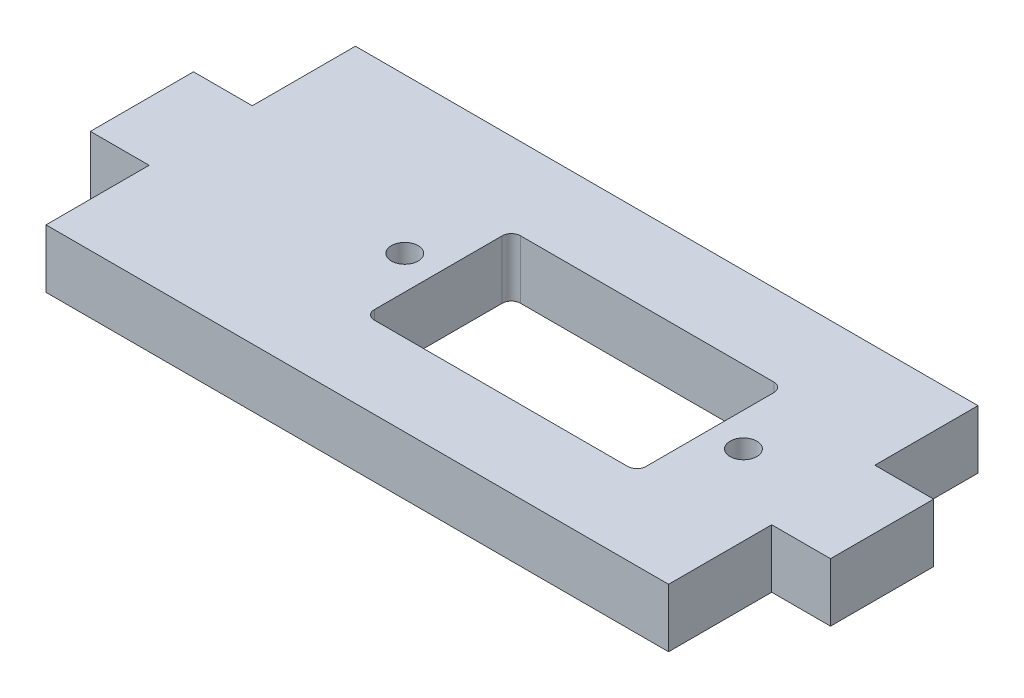
from build123d import *

# Parameters (mm, degrees)
SKETCH1_W           = 101.6
SKETCH1_H           = 25.4
BOSS_EXTRUDE1_DEPTH = 4.800000052
SKETCH2_R           = 1.1
CUT_EXTRUDE1_DEPTH  = 105.836825593
SKETCH3_W           = 4.826
SKETCH3_H           = 8.466666667
CUT_EXTRUDE2_DEPTH  = 105.836825593
SKETCH4_W           = 17.969778324
SKETCH4_H           = 25.4
SKETCH4_W_2         = 22.871809623
CUT_EXTRUDE3_DEPTH  = 105.836825593


with BuildPart() as part:
    # Sketch1 → Boss-Extrude1 (new body)
    with BuildSketch(Plane(origin=(0, 0, 0), x_dir=(1, 0, 0), z_dir=(0, 1, 0))):
        with Locations((50.8, 12.7)):
            Rectangle(SKETCH1_W, SKETCH1_H)
    extrude(amount=BOSS_EXTRUDE1_DEPTH)

    # Sketch2 → Cut-Extrude1 (cut, through all)
    with BuildSketch(Plane(origin=(0, 4.800000052, 0), x_dir=(1, 0, 0), z_dir=(0, 1, 0))):
        with Locations(Location((72.250000026, 12.7, 0), (0, 0, 270))):
            Circle(SKETCH2_R)
        with Locations(Location((44.450000026, 12.7, 0), (0, 0, 270))):
            Circle(SKETCH2_R)
    extrude(amount=-CUT_EXTRUDE1_DEPTH, mode=Mode.SUBTRACT)

    # Sketch3 → Cut-Extrude2 (cut, through all)
    with BuildSketch(Plane.XZ):
        with BuildLine():
            Line((69.500000026, -17.95), (69.500000026, -7.45))
            ThreePointArc((69.500000026, -7.45), (69.280330112, -6.919669914), (68.750000026, -6.7))
            Line((68.750000026, -6.7), (47.950000026, -6.7))
            ThreePointArc((47.950000026, -6.7), (47.41966994, -6.919669914), (47.200000026, -7.45))
            Line((47.200000026, -7.45), (47.200000026, -17.95))
            ThreePointArc((47.200000026, -17.95), (47.41966994, -18.480330086), (47.950000026, -18.7))
            Line((47.950000026, -18.7), (68.750000026, -18.7))
            ThreePointArc((68.750000026, -18.7), (69.280330112, -18.480330086), (69.500000026, -17.95))
        make_face()
        with Locations((25.284809623, -4.233333334)):
            Rectangle(SKETCH3_W, SKETCH3_H)
        with Locations((81.217221676, -4.233333334)):
            Rectangle(SKETCH3_W, SKETCH3_H)
        with Locations((25.284809623, -21.166666666)):
            Rectangle(SKETCH3_W, SKETCH3_H)
        with Locations((81.217221676, -21.166666666)):
            Rectangle(SKETCH3_W, SKETCH3_H)
    extrude(amount=-CUT_EXTRUDE2_DEPTH, mode=Mode.SUBTRACT)

    # Sketch4 → Cut-Extrude3 (cut, through all)
    with BuildSketch(Plane.XZ):
        with Locations((92.615110838, -12.7)):
            Rectangle(SKETCH4_W, SKETCH4_H)
        with Locations((11.435904812, -12.7)):
            Rectangle(SKETCH4_W_2, SKETCH4_H)
    extrude(amount=-CUT_EXTRUDE3_DEPTH, mode=Mode.SUBTRACT)


solid = part.part
